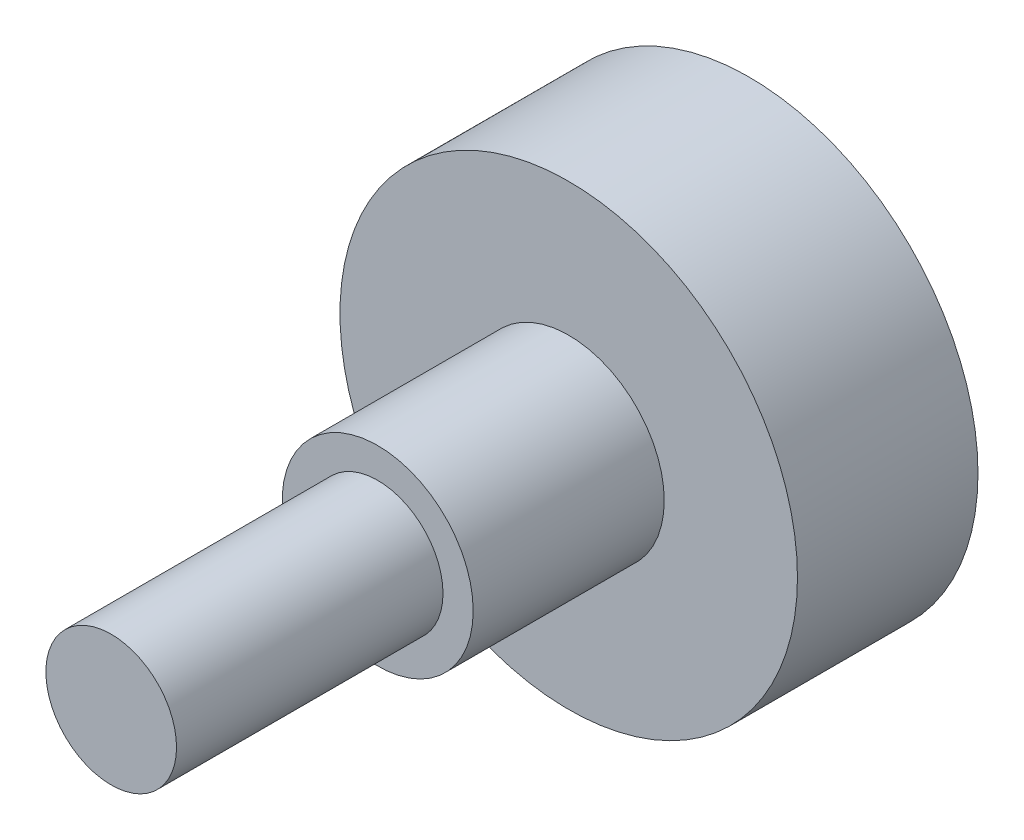
from build123d import *

# Parameters (mm, degrees)
SKETCH1_R           = 11.1
SKETCH1_R_2         = 4.635
BOSS_EXTRUDE1_DEPTH = 8.76
SKETCH3_R           = 4.635
BOSS_EXTRUDE2_DEPTH = 22.2
CUT_EXTRUDE3_START  = -12.93
SKETCH4_R           = 4.635
SKETCH4_R_2         = 3.17
CUT_EXTRUDE3_DEPTH  = 12.93


with BuildPart() as part:
    # Sketch1 → Boss-Extrude1 (new body)
    with BuildSketch(Plane.XY):
        Circle(SKETCH1_R)
        Circle(SKETCH1_R_2, mode=Mode.SUBTRACT)
    extrude(amount=BOSS_EXTRUDE1_DEPTH)


with BuildPart() as body_2:
    # Sketch3 → Boss-Extrude2 (new body)
    with BuildSketch(Plane.XY.offset(8.76)):
        Circle(SKETCH3_R)
    extrude(amount=BOSS_EXTRUDE2_DEPTH)

    # Sketch4 → Cut-Extrude3 (cut)
    with BuildSketch(Plane.XY.offset(30.96).offset(CUT_EXTRUDE3_START)):
        Circle(SKETCH4_R)
        Circle(SKETCH4_R_2, mode=Mode.SUBTRACT)
    extrude(amount=CUT_EXTRUDE3_DEPTH, mode=Mode.SUBTRACT)


solid = Compound([part.part, body_2.part])
